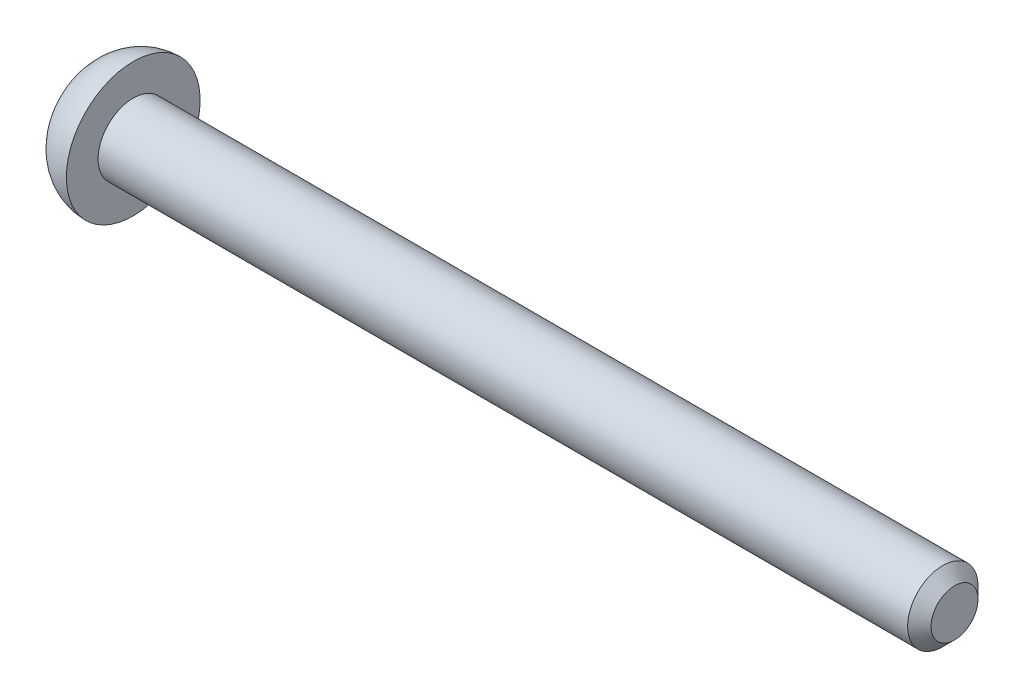
from build123d import *

# Parameters (mm, degrees)
CHAMFER1_SIZE      = 0.5
CUT_EXTRUDE1_DEPTH = 1


with BuildPart() as part:
    # Sketch2 → Revolve1 (revolve)
    with BuildSketch(Plane(origin=(0, 0, 0), x_dir=(1, 0, 0), z_dir=(0, 1, 0)), mode=Mode.PRIVATE) as revolve1_sk:
        with BuildLine():
            Line((0, 0), (0, 1.5))
            Line((0, 1.5), (-35, 1.5))
            Line((-35, 1.5), (-35, 2.85))
            ThreePointArc((-35, 2.85), (-35.917065968, 2.639177072), (-36.65, 2.049038106))
            Line((-36.65, 2.049038106), (-36.65, 0))
            Line((-36.65, 0), (0, 0))
        make_face()
    revolve(revolve1_sk.sketch.rotate(Axis((-36.65, 0, 0), (1, 0, 0)), 180), axis=Axis((-36.65, 0, 0), (1, 0, 0)))

    # Chamfer1
    chamfer1_edges = [part.edges().sort_by_distance(p)[0] for p in [
        (0, 0, -1.5),
    ]]
    chamfer(chamfer1_edges, length=CHAMFER1_SIZE)

    # Sketch4 → Cut-Extrude1 (cut)
    with BuildSketch(Plane.ZY.offset(36.65)):
        with BuildLine():
            ThreePointArc((-1.342027284, 0.090739778), (-0.883315009, 0.509982158), (-0.749596595, 1.116859832))
            ThreePointArc((-0.749596595, 1.116859832), (-0.7, 1.212435565), (-0.592430689, 1.20759961))
            ThreePointArc((-0.592430689, 1.20759961), (0, 1.019964317), (0.592430689, 1.20759961))
            ThreePointArc((0.592430689, 1.20759961), (0.7, 1.212435565), (0.749596595, 1.116859832))
            ThreePointArc((0.749596595, 1.116859832), (0.883315009, 0.509982158), (1.342027284, 0.090739778))
            ThreePointArc((1.342027284, 0.090739778), (1.4, 0), (1.342027284, -0.090739778))
            ThreePointArc((1.342027284, -0.090739778), (0.883315009, -0.509982158), (0.749596595, -1.116859832))
            ThreePointArc((0.749596595, -1.116859832), (0.7, -1.212435565), (0.592430689, -1.20759961))
            ThreePointArc((0.592430689, -1.20759961), (0, -1.019964317), (-0.592430689, -1.20759961))
            ThreePointArc((-0.592430689, -1.20759961), (-0.7, -1.212435565), (-0.749596595, -1.116859832))
            ThreePointArc((-0.749596595, -1.116859832), (-0.883315009, -0.509982158), (-1.342027284, -0.090739778))
            ThreePointArc((-1.342027284, -0.090739778), (-1.4, 0), (-1.342027284, 0.090739778))
        make_face()
    extrude(amount=-CUT_EXTRUDE1_DEPTH, mode=Mode.SUBTRACT)


solid = part.part
